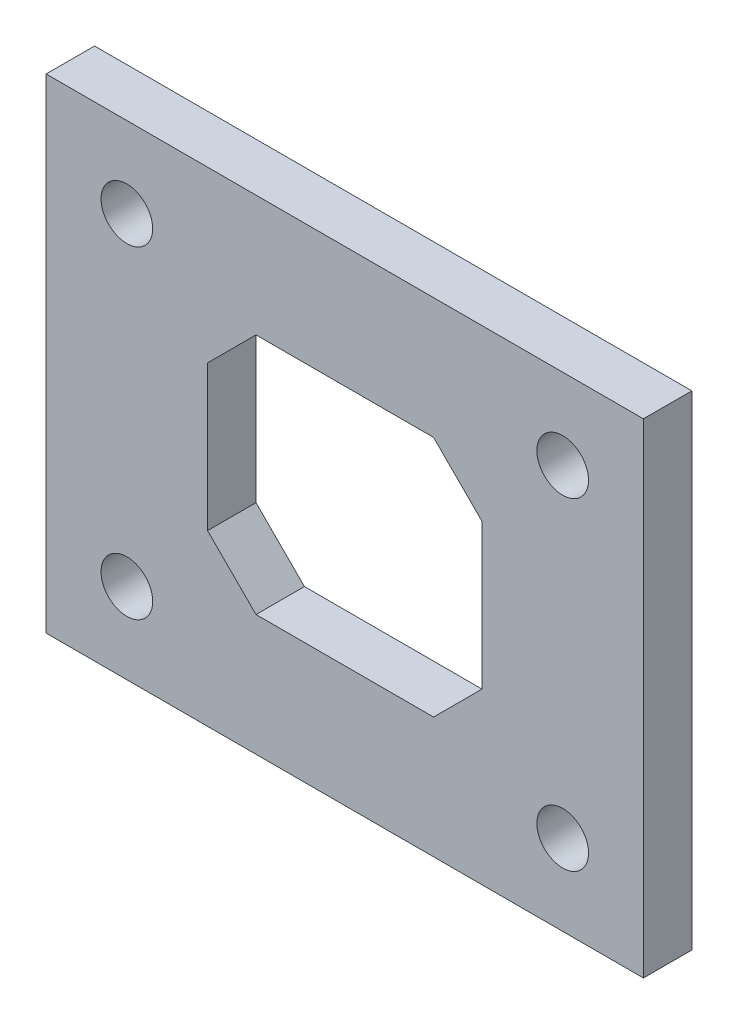
from build123d import *

# Parameters (mm, degrees)
SKETCH_1_W          = 37
SKETCH_1_H          = 120
SKETCH_1_R          = 1.6
SKETCH_1_R_2        = 3
EXTRUDE_1_DEPTH     = 3
SKETCH_2_W          = 37
SKETCH_2_H          = 90
CUT_EXTRUDE_1_DEPTH = 3
SKETCH_3_W          = 17
SKETCH_3_H          = 15
CUT_EXTRUDE_2_DEPTH = 63.858969129
CHAMFER_1_SIZE      = 3


with BuildPart() as part:
    # ｽｹｯﾁ1 → ﾎﾞｽ - 押し出し1 (new body)
    # profile 1 of 2: a face of its own
    with BuildSketch(Plane.XY):
        Rectangle(SKETCH_1_W, SKETCH_1_H)
        with Locations((13.5, -55)):
            Circle(SKETCH_1_R, mode=Mode.SUBTRACT)
        with Locations((13.5, -35)):
            Circle(SKETCH_1_R_2, mode=Mode.SUBTRACT)
        with Locations((-13.5, -55)):
            Circle(SKETCH_1_R, mode=Mode.SUBTRACT)
        with Locations((-13.5, -35)):
            Circle(SKETCH_1_R_2, mode=Mode.SUBTRACT)
        with Locations((13.5, 35)):
            Circle(SKETCH_1_R, mode=Mode.SUBTRACT)
        with Locations((13.5, 55)):
            Circle(SKETCH_1_R, mode=Mode.SUBTRACT)
        with Locations((-13.5, 35)):
            Circle(SKETCH_1_R, mode=Mode.SUBTRACT)
        with Locations((-13.5, 55)):
            Circle(SKETCH_1_R, mode=Mode.SUBTRACT)
    # profile 2 of 2: a face of its own
    with BuildSketch(Plane.XY):
        Polygon((-18.5, -25), (-18.5, -60), (18.5, -60), (18.5, 60), (-18.5, 60), (-18.5, 25), align=None)
        with Locations((-13.5, -55)):
            Circle(SKETCH_1_R, mode=Mode.SUBTRACT)
        with Locations((-13.5, -35)):
            Circle(SKETCH_1_R_2, mode=Mode.SUBTRACT)
        with Locations((13.5, -55)):
            Circle(SKETCH_1_R, mode=Mode.SUBTRACT)
        with Locations((13.5, -35)):
            Circle(SKETCH_1_R_2, mode=Mode.SUBTRACT)
        with Locations((-13.5, 35)):
            Circle(SKETCH_1_R, mode=Mode.SUBTRACT)
        with Locations((-13.5, 55)):
            Circle(SKETCH_1_R, mode=Mode.SUBTRACT)
        with Locations((13.5, 35)):
            Circle(SKETCH_1_R, mode=Mode.SUBTRACT)
        with Locations((13.5, 55)):
            Circle(SKETCH_1_R, mode=Mode.SUBTRACT)
    extrude(amount=EXTRUDE_1_DEPTH)

    # ｽｹｯﾁ2 → ｶｯﾄ - 押し出し1 (cut)
    with BuildSketch(Plane.XY.offset(3)):
        with Locations((0, -15)):
            Rectangle(SKETCH_2_W, SKETCH_2_H)
    extrude(amount=-CUT_EXTRUDE_1_DEPTH, mode=Mode.SUBTRACT)

    # ｽｹｯﾁ3 → ｶｯﾄ - 押し出し2 (cut, through all)
    with BuildSketch(Plane(origin=(0, 0, 0), x_dir=(-1, 0, 0), z_dir=(0, 0, -1))):
        with Locations((0, 45)):
            Rectangle(SKETCH_3_W, SKETCH_3_H)
    extrude(amount=-CUT_EXTRUDE_2_DEPTH, mode=Mode.SUBTRACT)

    # 面取り1
    chamfer_1_edges = [part.edges().sort_by_distance(p)[0] for p in [
        (8.5, 37.5, 1.5),
        (8.5, 52.5, 1.5),
        (-8.5, 52.5, 1.5),
        (-8.5, 37.5, 1.5),
    ]]
    chamfer(chamfer_1_edges, length=CHAMFER_1_SIZE)


solid = part.part
